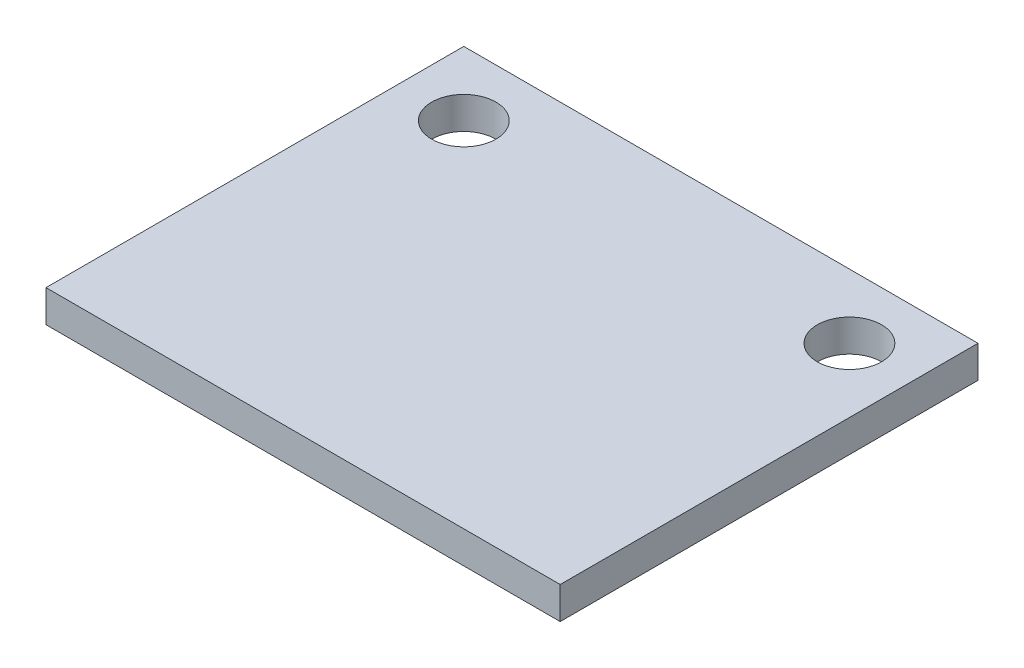
from build123d import *

# Parameters (mm, degrees)
SKETCH1_W           = 80
SKETCH1_H           = 65
SKETCH1_R           = 5
BOSS_EXTRUDE1_DEPTH = 5
SCALE2_SCALE        = 0.1


with BuildPart() as part:
    # Sketch1 → Boss-Extrude1 (new body)
    with BuildSketch(Plane(origin=(0, 0, 0), x_dir=(1, 0, 0), z_dir=(0, 1, 0))):
        with Locations((0, 7.5)):
            Rectangle(SKETCH1_W, SKETCH1_H)
        with Locations(Location((-30, 30, 0), (0, 0, 270))):
            Circle(SKETCH1_R, mode=Mode.SUBTRACT)
        with Locations(Location((30, 30, 0), (0, 0, 270))):
            Circle(SKETCH1_R, mode=Mode.SUBTRACT)
    extrude(amount=BOSS_EXTRUDE1_DEPTH)


with BuildPart() as part_1:
    # Scale2: scaled about (0, 2.5, -6.799157734)
    add(part.part.scale(SCALE2_SCALE).moved(Location((0, 2.25, -6.119241961))))


solid = part_1.part
